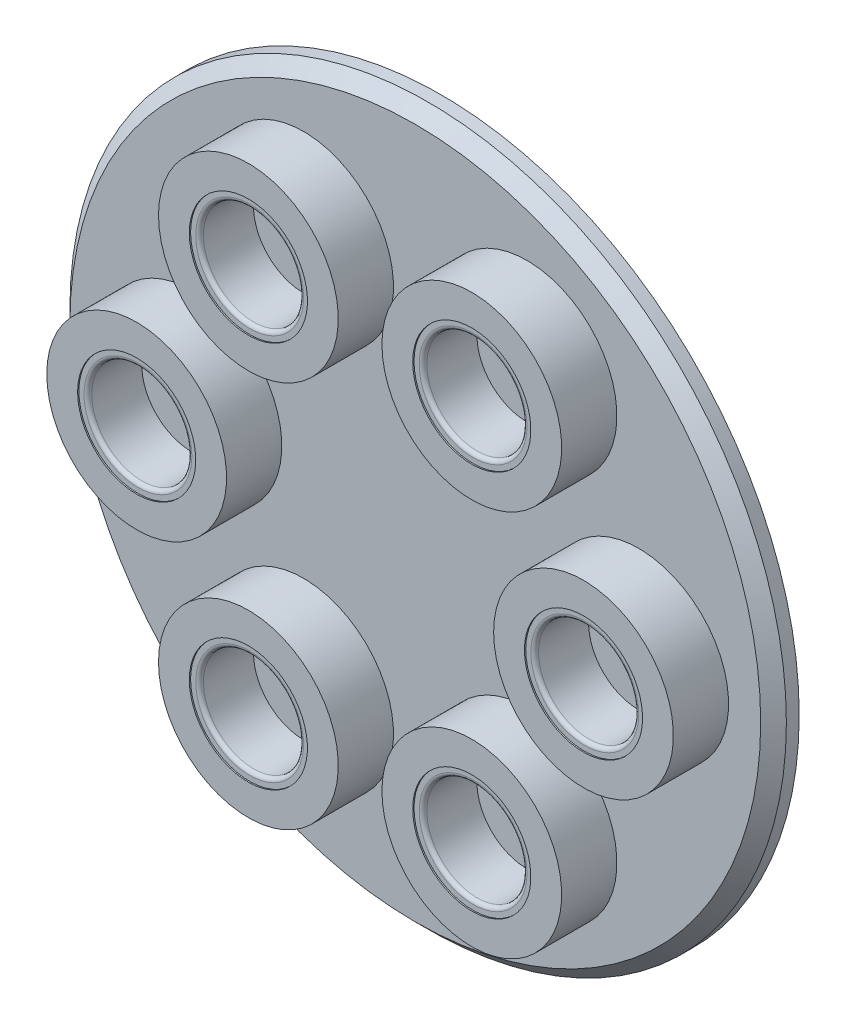
from build123d import *

# Parameters (mm, degrees)
SKETCH1_R           = 27.9
BOSS_EXTRUDE1_DEPTH = 2
CHAMFER1_SIZE       = 1
SKETCH2_R           = 7
SKETCH2_R_2         = 4.6
BOSS_EXTRUDE2_DEPTH = 4.3
SKETCH3_R           = 4.6
SKETCH3_R_2         = 3.9
BOSS_EXTRUDE4_DEPTH = 4.2
FILLET1_R           = 0.3


with BuildPart() as part:
    # Sketch1 → Boss-Extrude1 (new body)
    with BuildSketch(Plane.XY):
        Circle(SKETCH1_R)
    extrude(amount=BOSS_EXTRUDE1_DEPTH)

    # Chamfer1
    chamfer1_edges = [part.edges().sort_by_distance(p)[0] for p in [
        (-27.9, 0, 2),
    ]]
    chamfer(chamfer1_edges, length=CHAMFER1_SIZE)

    # Sketch2 → Boss-Extrude2 (add)
    # profile 1 of 6: a face of its own
    with BuildSketch(Plane.XY.offset(2)):
        with Locations(Location((-8.7, 15.068842026, 0), (0, 0, 180))):
            Circle(SKETCH2_R)
        with Locations(Location((-8.7, 15.068842026, 0), (0, 0, 180))):
            Circle(SKETCH2_R_2, mode=Mode.SUBTRACT)
    # profile 2 of 6: a face of its own
    with BuildSketch(Plane.XY.offset(2)):
        with Locations(Location((8.7, 15.068842026, 0), (0, 0, 180))):
            Circle(SKETCH2_R)
        with Locations(Location((8.7, 15.068842026, 0), (0, 0, 180))):
            Circle(SKETCH2_R_2, mode=Mode.SUBTRACT)
    # profile 3 of 6: a face of its own
    with BuildSketch(Plane.XY.offset(2)):
        with Locations(Location((17.4, 0, 0), (0, 0, 180))):
            Circle(SKETCH2_R)
        with Locations(Location((17.4, 0, 0), (0, 0, 180))):
            Circle(SKETCH2_R_2, mode=Mode.SUBTRACT)
    # profile 4 of 6: a face of its own
    with BuildSketch(Plane.XY.offset(2)):
        with Locations(Location((8.7, -15.068842026, 0), (0, 0, 180))):
            Circle(SKETCH2_R)
        with Locations(Location((8.7, -15.068842026, 0), (0, 0, 180))):
            Circle(SKETCH2_R_2, mode=Mode.SUBTRACT)
    # profile 5 of 6: a face of its own
    with BuildSketch(Plane.XY.offset(2)):
        with Locations(Location((-8.7, -15.068842026, 0), (0, 0, 180))):
            Circle(SKETCH2_R)
        with Locations(Location((-8.7, -15.068842026, 0), (0, 0, 180))):
            Circle(SKETCH2_R_2, mode=Mode.SUBTRACT)
    # profile 6 of 6: a face of its own
    with BuildSketch(Plane.XY.offset(2)):
        with Locations(Location((-17.4, 0, 0), (0, 0, 180))):
            Circle(SKETCH2_R)
        with Locations(Location((-17.4, 0, 0), (0, 0, 180))):
            Circle(SKETCH2_R_2, mode=Mode.SUBTRACT)
    extrude(amount=BOSS_EXTRUDE2_DEPTH)

    # Sketch3 → Boss-Extrude4 (add)
    # profile 1 of 6: a face of its own
    with BuildSketch(Plane.XY.offset(2)):
        with Locations(Location((8.7, 15.068842026, 0), (0, 0, 180))):
            Circle(SKETCH3_R)
        with Locations((8.7, 15.068842026)):
            Circle(SKETCH3_R_2, mode=Mode.SUBTRACT)
    # profile 2 of 6: a face of its own
    with BuildSketch(Plane.XY.offset(2)):
        with Locations(Location((-8.7, 15.068842026, 0), (0, 0, 180))):
            Circle(SKETCH3_R)
        with Locations((-8.7, 15.068842026)):
            Circle(SKETCH3_R_2, mode=Mode.SUBTRACT)
    # profile 3 of 6: a face of its own
    with BuildSketch(Plane.XY.offset(2)):
        with Locations(Location((17.4, 0, 0), (0, 0, 180))):
            Circle(SKETCH3_R)
        with Locations((17.4, 0)):
            Circle(SKETCH3_R_2, mode=Mode.SUBTRACT)
    # profile 4 of 6: a face of its own
    with BuildSketch(Plane.XY.offset(2)):
        with Locations(Location((8.7, -15.068842026, 0), (0, 0, 180))):
            Circle(SKETCH3_R)
        with Locations((8.7, -15.068842026)):
            Circle(SKETCH3_R_2, mode=Mode.SUBTRACT)
    # profile 5 of 6: a face of its own
    with BuildSketch(Plane.XY.offset(2)):
        with Locations(Location((-8.7, -15.068842026, 0), (0, 0, 180))):
            Circle(SKETCH3_R)
        with Locations((-8.7, -15.068842026)):
            Circle(SKETCH3_R_2, mode=Mode.SUBTRACT)
    # profile 6 of 6: a face of its own
    with BuildSketch(Plane.XY.offset(2)):
        with Locations(Location((-17.4, 0, 0), (0, 0, 180))):
            Circle(SKETCH3_R)
        with Locations((-17.4, 0)):
            Circle(SKETCH3_R_2, mode=Mode.SUBTRACT)
    extrude(amount=BOSS_EXTRUDE4_DEPTH)

    # Fillet1
    fillet1_edges = [part.edges().sort_by_distance(p)[0] for p in [
        (4.8, 15.068842026, 6.2),
        (-12.6, 15.068842026, 6.2),
        (4.8, -15.068842026, 6.2),
        (13.5, 0, 6.2),
        (-21.3, 0, 6.2),
        (-12.6, -15.068842026, 6.2),
    ]]
    fillet(fillet1_edges, radius=FILLET1_R)


solid = part.part
